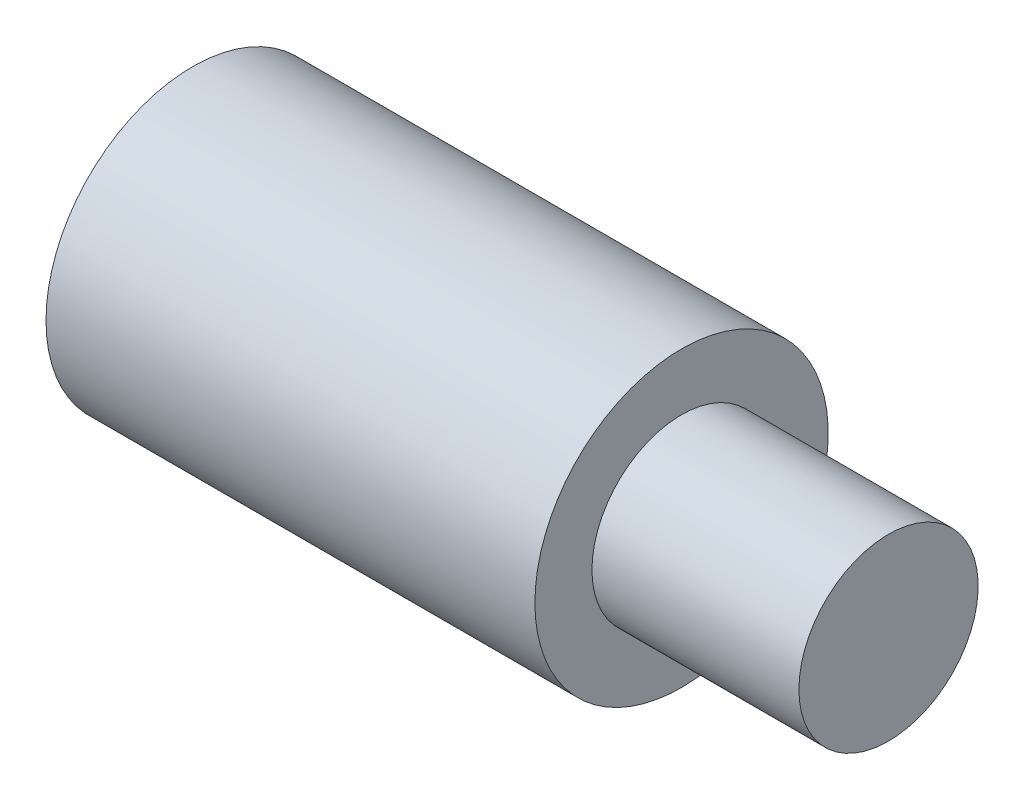
from build123d import *

# Parameters (mm, degrees)
SOCKET_1_SKETCH_W = 15
SOCKET_1_SKETCH_H = 5.5


with BuildPart() as part:
    # NPT_Ext_30 Sketch → NPT_Ext_30 (revolve)
    with BuildSketch(Plane.XY):
        Polygon((12.7, 0), (12.7, 5.5), (0, 5.5), (0, 9), (-30, 9), (-30, 0), align=None)
    revolve(axis=Axis((-1000, 0, 0), (1, 0, 0)))

    # Socket 1 Sketch → Socket 1 (revolve, cut)
    with BuildSketch(Plane.XY):
        with Locations((-23.5, 2.75)):
            Rectangle(SOCKET_1_SKETCH_W, SOCKET_1_SKETCH_H)
    revolve(axis=Axis((-1000, 0, 0), (1, 0, 0)), mode=Mode.SUBTRACT)


solid = part.part
